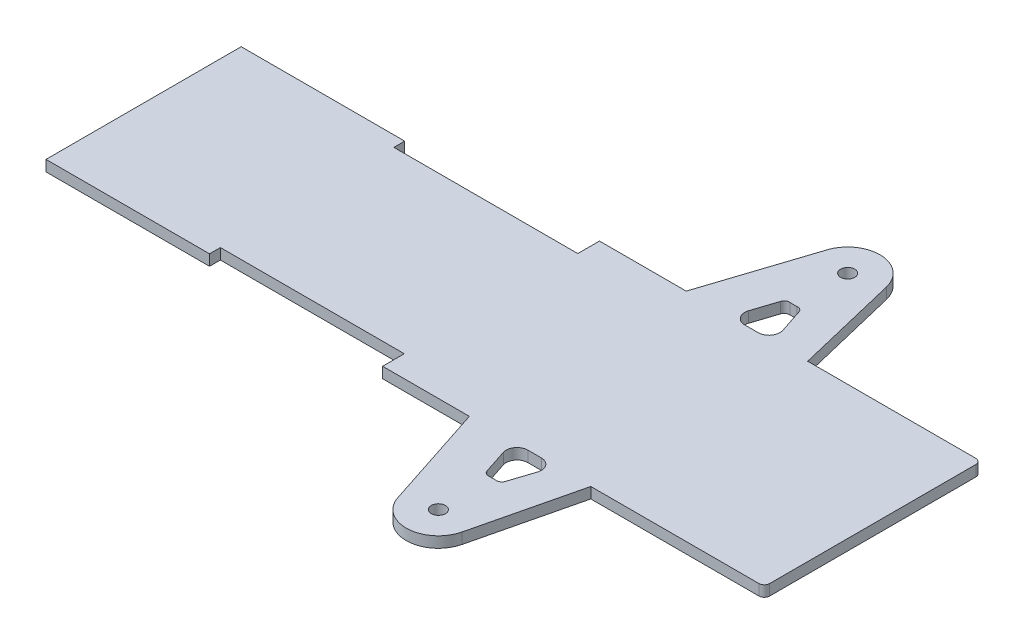
from build123d import *

# Parameters (mm, degrees)
SKETCH1_R           = 2.0828
BOSS_EXTRUDE1_DEPTH = 3.175
FILLET1_R           = 1.5875
FILLET2_R           = 3.175
FILLET3_R           = 1.5875


with BuildPart() as part:
    # Sketch1 → Boss-Extrude1 (new body)
    with BuildSketch(Plane(origin=(0, 0, 0), x_dir=(1, 0, 0), z_dir=(0, 1, 0))):
        with BuildLine():
            Line((26.924, -25.4), (-26.924, -25.4))
            Line((-26.924, -25.4), (-26.924, -28.575))
            Line((-26.924, -28.575), (-46.228, -28.575))
            Line((-46.228, -28.575), (-74.803, -28.575))
            Line((-74.803, -28.575), (-74.803, 28.575))
            Line((-74.803, 28.575), (-46.228, 28.575))
            Line((-46.228, 28.575), (-26.924, 28.575))
            Line((-26.924, 28.575), (-26.924, 25.4))
            Line((-26.924, 25.4), (26.924, 25.4))
            Line((26.924, 25.4), (26.924, 31.75))
            Line((26.924, 31.75), (52.324, 31.75))
            Line((52.324, 31.75), (62.607581289, 63.240132856))
            ThreePointArc((62.607581289, 63.240132856), (72.010560326, 69.32064995), (80.585058538, 62.118797179))
            Line((80.585058538, 62.118797179), (87.884, 31.75))
            Line((87.884, 31.75), (138.684, 31.75))
            Line((138.684, 31.75), (138.684, -31.75))
            Line((138.684, -31.75), (87.884, -31.75))
            Line((87.884, -31.75), (80.585058538, -62.118797179))
            ThreePointArc((80.585058538, -62.118797179), (72.010560326, -69.32064995), (62.607581289, -63.240132856))
            Line((62.607581289, -63.240132856), (52.324, -31.75))
            Line((52.324, -31.75), (26.924, -31.75))
            Line((26.924, -31.75), (26.924, -25.4))
        make_face()
        with Locations(Location((71.4240126, 59.9169998, 0), (0, 0, 270))):
            Circle(SKETCH1_R, mode=Mode.SUBTRACT)
        with Locations(Location((71.4240126, -59.9169998, 0), (0, 0, 90))):
            Circle(SKETCH1_R, mode=Mode.SUBTRACT)
        with BuildLine():
            Line((77.7740126, 31.75), (65.0740126, 31.75))
            Line((65.0740126, 31.75), (69.141994412, 44.206875103))
            ThreePointArc((69.141994412, 44.206875103), (71.4240126, 44.0419998), (73.706030788, 44.206875103))
            Line((73.706030788, 44.206875103), (77.7740126, 31.75))
        make_face(mode=Mode.SUBTRACT)
        with BuildLine():
            Line((77.7740126, -31.75), (73.706030788, -44.206875103))
            ThreePointArc((73.706030788, -44.206875103), (71.4240126, -44.0419998), (69.141994412, -44.206875103))
            Line((69.141994412, -44.206875103), (65.0740126, -31.75))
            Line((65.0740126, -31.75), (77.7740126, -31.75))
        make_face(mode=Mode.SUBTRACT)
    extrude(amount=BOSS_EXTRUDE1_DEPTH)

    # Fillet1
    fillet1_edges = [part.edges().sort_by_distance(p)[0] for p in [
        (69.141994412, 1.5875, 44.206875103),
        (73.706030788, 1.5875, 44.206875103),
        (69.141994412, 1.5875, -44.206875103),
        (73.706030788, 1.5875, -44.206875103),
    ]]
    fillet(fillet1_edges, radius=FILLET1_R)

    # Fillet2
    fillet2_edges = [part.edges().sort_by_distance(p)[0] for p in [
        (77.7740126, 1.5875, 31.75),
        (65.0740126, 1.5875, 31.75),
        (65.0740126, 1.5875, -31.75),
        (77.7740126, 1.5875, -31.75),
    ]]
    fillet(fillet2_edges, radius=FILLET2_R)

    # Fillet3
    fillet3_edges = [part.edges().sort_by_distance(p)[0] for p in [
        (138.684, 1.5875, -31.75),
        (138.684, 1.5875, 31.75),
    ]]
    fillet(fillet3_edges, radius=FILLET3_R)


solid = part.part
